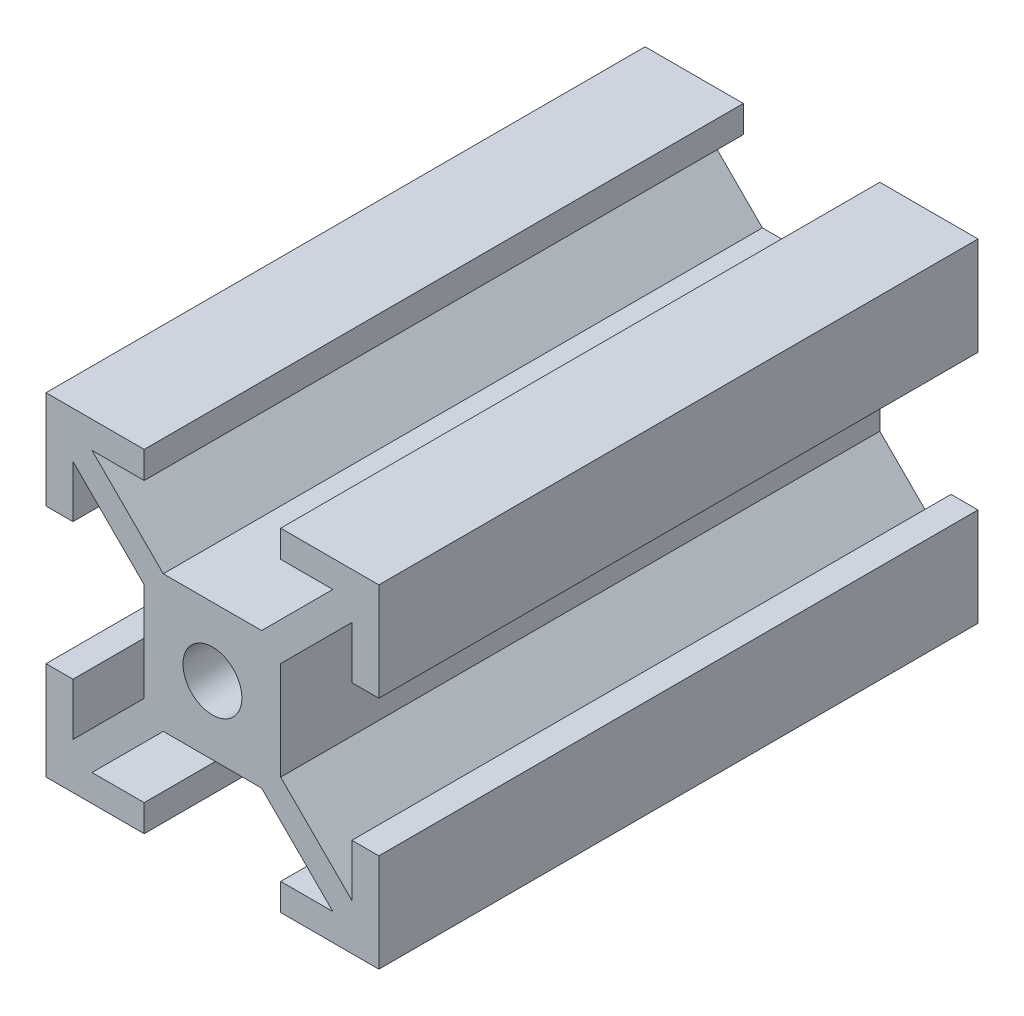
from build123d import *

# Parameters (mm, degrees)
SKETCH1_R           = 1.77
BOSS_EXTRUDE1_DEPTH = 36


with BuildPart() as part:
    # Sketch1 → Boss-Extrude1 (new body)
    with BuildSketch(Plane.XY):
        Polygon((-8.38, 4.1), (-10, 4.1), (-10, 10), (-4.1, 10), (-4.1, 8.38), (-7.234487014, 8.38), (-2.954487014, 4.1), (2.954487014, 4.1), (7.234487014, 8.38), (4.1, 8.38), (4.1, 10), (10, 10), (10, 4.1), (8.38, 4.1), (8.38, 7.234487014), (4.1, 2.954487014), (4.1, -2.954487014), (8.38, -7.234487014), (8.38, -4.1), (10, -4.1), (10, -10), (4.1, -10), (4.1, -8.38), (7.234487014, -8.38), (2.954487014, -4.1), (-2.954487014, -4.1), (-7.234487014, -8.38), (-4.1, -8.38), (-4.1, -10), (-10, -10), (-10, -4.1), (-8.38, -4.1), (-8.38, -7.234487014), (-4.1, -2.954487014), (-4.1, 2.954487014), (-8.38, 7.234487014), align=None)
        Circle(SKETCH1_R, mode=Mode.SUBTRACT)
    extrude(amount=BOSS_EXTRUDE1_DEPTH)


solid = part.part
